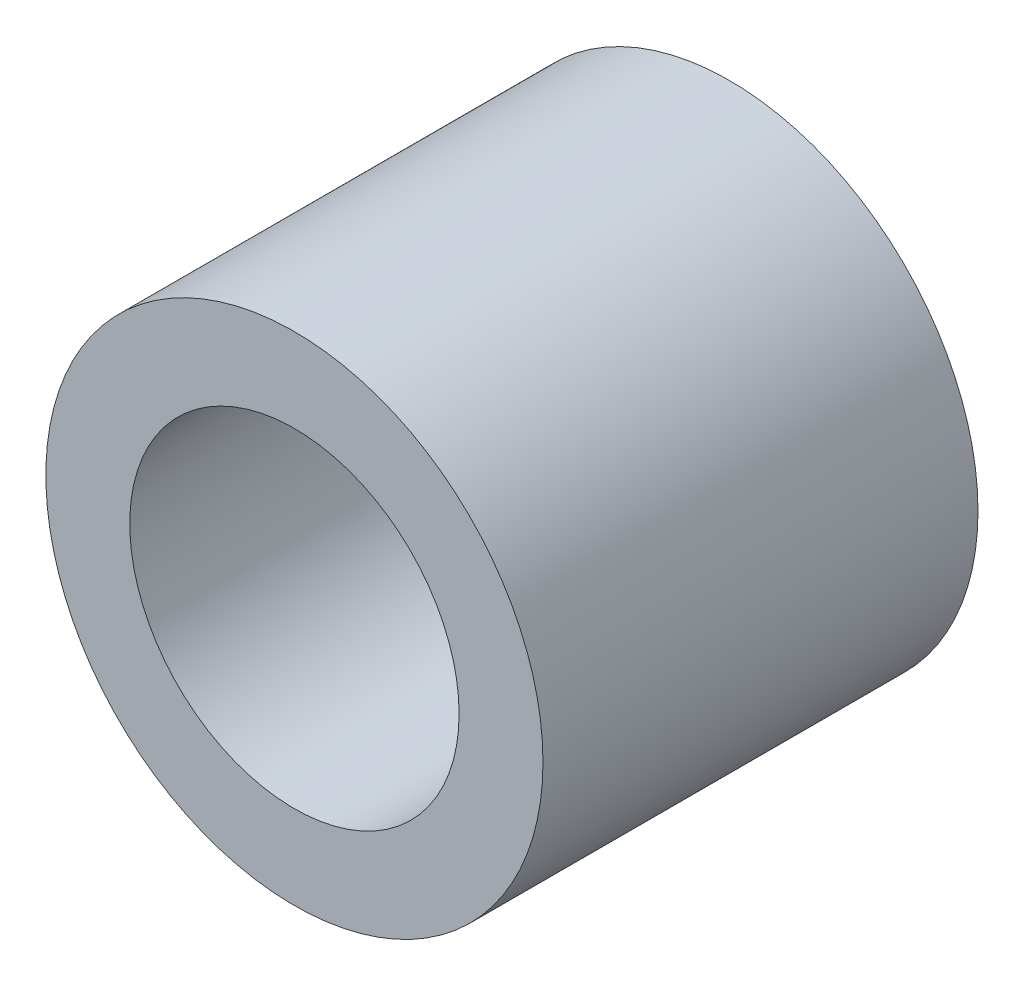
from build123d import *

# Parameters (mm, degrees)
SKETCH1_R           = 4
BOSS_EXTRUDE1_DEPTH = 7
CUT_EXTRUDE1_REACH  = 11
SKETCH2_R           = 2.65


with BuildPart() as part:
    # Sketch1 → Boss-Extrude1 (new body)
    with BuildSketch(Plane.XY):
        Circle(SKETCH1_R)
    extrude(amount=BOSS_EXTRUDE1_DEPTH)

    # Sketch2 → Cut-Extrude1 (cut, up to next)
    with BuildSketch(Plane.XY.offset(7), mode=Mode.PRIVATE) as cut_extrude1_sk1:
        Circle(SKETCH2_R)
    cut_extrude1_tool1 = extrude(cut_extrude1_sk1.sketch, amount=-CUT_EXTRUDE1_REACH, mode=Mode.PRIVATE) & part.part
    add(cut_extrude1_tool1.solids().sort_by_distance((0, 0, 7))[0], mode=Mode.SUBTRACT)


solid = part.part
